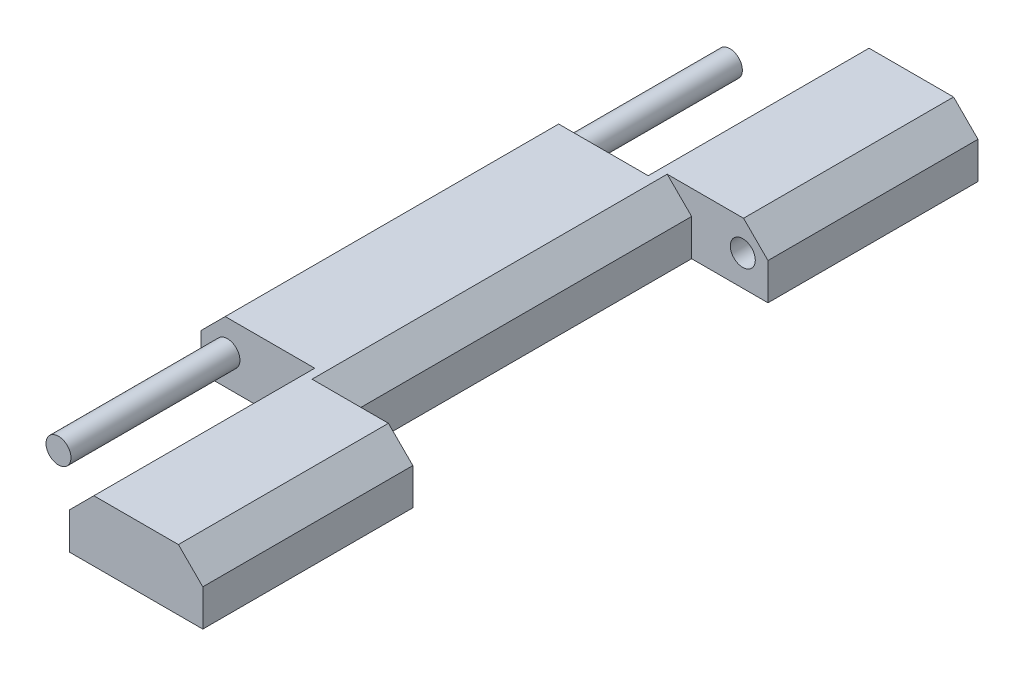
from build123d import *

# Parameters (mm, degrees)
BOSS_EXTRUDE1_DEPTH = 5
CHAMFER1_SIZE       = 2
BOSS_EXTRUDE2_START = -13.657774
SKETCH3_R           = 1.021691407
BOSS_EXTRUDE2_DEPTH = 27.5
CUT_EXTRUDE1_START  = 14.545359
SKETCH5_R           = 1.021691407
CUT_EXTRUDE1_DEPTH  = 27.5
SCALE1_SCALE        = 1.35


with BuildPart() as part:
    # Sketch1 → Boss-Extrude1 (new body)
    with BuildSketch(Plane(origin=(0, 0, 0), x_dir=(1, 0, 0), z_dir=(0, 1, 0))):
        Polygon((5.462106298, -14.545359038), (5.462106298, -31.75), (-5.462106298, -31.75), (-5.462106298, -13.65777411), (-12.795805827, -13.65777411), (-12.795805827, 13.65777411), (-5.462106298, 13.65777411), (-5.462106298, 31.75), (5.462106298, 31.75), (5.462106298, 14.545359038), (-0.792098737, 14.545359038), (-0.792098737, -14.545359038), align=None)
    extrude(amount=BOSS_EXTRUDE1_DEPTH)

    # Chamfer1
    chamfer1_edges = [part.edges().sort_by_distance(p)[0] for p in [
        (-0.792098737, 5, 0),
        (5.462106298, 5, -23.147679519),
        (-5.462106298, 5, -22.703887055),
        (-12.795805827, 5, 0),
        (-5.462106298, 5, 22.703887055),
        (5.462106298, 5, 23.147679519),
    ]]
    chamfer(chamfer1_edges, length=CHAMFER1_SIZE)

    # Sketch3 → Boss-Extrude2 (add, symmetric)
    with BuildSketch(Plane(origin=(5.602975804, 0, 13.65777411), x_dir=(1, 0, 0), z_dir=(0, 0, 1)).offset(BOSS_EXTRUDE2_START)):
        with Locations(Location((-16.214711164, 2.5, 0), (0, 0, 180))):
            Circle(SKETCH3_R)
    extrude(amount=BOSS_EXTRUDE2_DEPTH, both=True)

    # Sketch5 → Cut-Extrude1 (cut, symmetric)
    with BuildSketch(Plane.XY.offset(-14.545359038).offset(CUT_EXTRUDE1_START)):
        with Locations(Location((3.400290851, 2.5, 0), (0, 0, 180))):
            Circle(SKETCH5_R)
    extrude(amount=CUT_EXTRUDE1_DEPTH, both=True, mode=Mode.SUBTRACT)


with BuildPart() as part_1:
    # Scale1: scaled about (-3.549226063, 2.359407906, 8e-09)
    add(part.part.scale(SCALE1_SCALE).moved(Location((1.242229122, -0.825792767, -3e-09))))


solid = part_1.part
